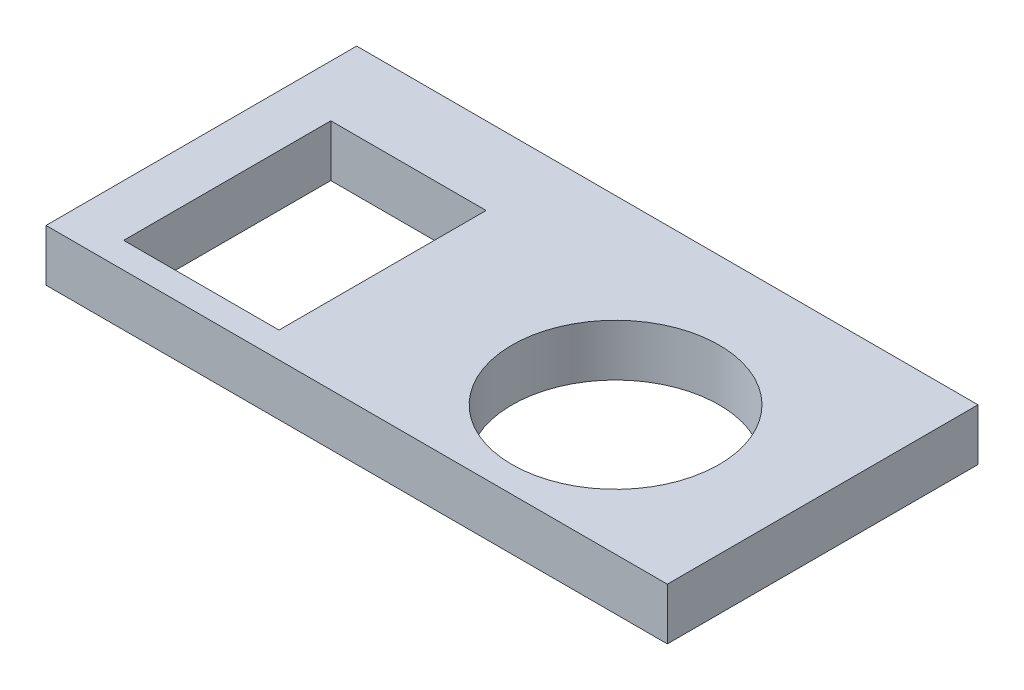
from build123d import *

# Parameters (mm, degrees)
SKIZZE1_W                       = 120
SKIZZE1_H                       = 50
AUFSATZ_LINEAR_AUSTRAGEN1_DEPTH = 10
SKIZZE3_R                       = 20
SKIZZE3_W                       = 30
SKIZZE3_H                       = 40
SCHNITT_LINEAR_AUSTRAGEN1_DEPTH = 66.76473219
SKIZZE4_W                       = 120
SKIZZE4_H                       = 10
AUFSATZ_LINEAR_AUSTRAGEN2_DEPTH = 10


with BuildPart() as part:
    # Skizze1 → Aufsatz-Linear austragen1 (new body)
    with BuildSketch(Plane(origin=(0, 0, 0), x_dir=(1, 0, 0), z_dir=(0, 1, 0))):
        Rectangle(SKIZZE1_W, SKIZZE1_H)
    extrude(amount=AUFSATZ_LINEAR_AUSTRAGEN1_DEPTH)

    # Skizze3 → Schnitt-Linear austragen1 (cut, through all)
    with BuildSketch(Plane(origin=(0, 10, 0), x_dir=(1, 0, 0), z_dir=(0, 1, 0))):
        with Locations(Location((25, 0, 0), (0, 0, 270))):
            Circle(SKIZZE3_R)
        with Locations((-35, 0)):
            Rectangle(SKIZZE3_W, SKIZZE3_H)
    extrude(amount=-SCHNITT_LINEAR_AUSTRAGEN1_DEPTH, mode=Mode.SUBTRACT)

    # Skizze4 → Aufsatz-Linear austragen2 (add)
    with BuildSketch(Plane(origin=(0, 10, 0), x_dir=(1, 0, 0), z_dir=(0, 1, 0))):
        with Locations((0, 30)):
            Rectangle(SKIZZE4_W, SKIZZE4_H)
    extrude(amount=-AUFSATZ_LINEAR_AUSTRAGEN2_DEPTH)


solid = part.part
